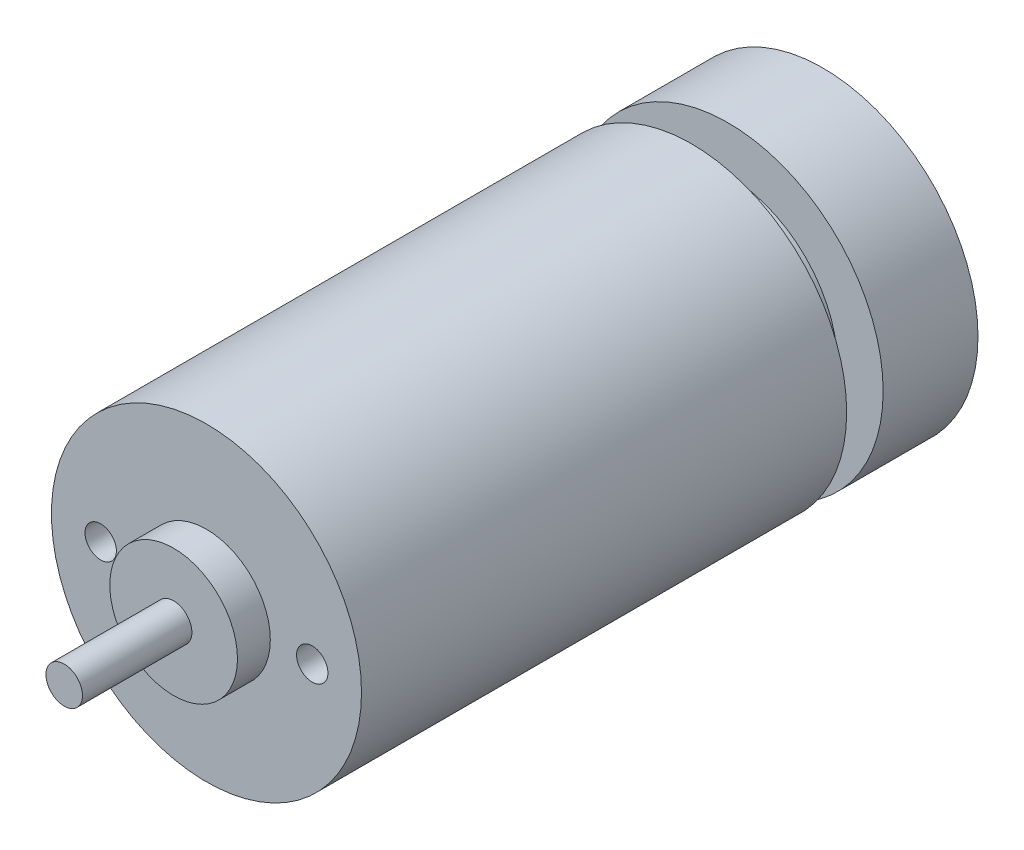
from build123d import *

# Parameters (mm, degrees)
SKIZZE1_R                       = 21.25
AUFSATZ_LINEAR_AUSTRAGEN1_DEPTH = 66.5
SKIZZE2_R                       = 8.75
AUFSATZ_LINEAR_AUSTRAGEN2_DEPTH = 4.5
SKIZZE3_R                       = 2.5
AUFSATZ_LINEAR_AUSTRAGEN3_DEPTH = 15
SKIZZE4_R                       = 2.15
SCHNITT_LINEAR_AUSTRAGEN1_DEPTH = 10
SKIZZE5_R                       = 15
AUFSATZ_LINEAR_AUSTRAGEN4_DEPTH = 5
AUFSATZ_LINEAR_START            = 13
SKIZZE6_R                       = 21.25
AUFSATZ_LINEAR_AUSTRAGEN5_DEPTH = 13


with BuildPart() as part:
    # Skizze1 → Aufsatz-Linear austragen1 (new body)
    with BuildSketch(Plane.XY):
        Circle(SKIZZE1_R)
    extrude(amount=AUFSATZ_LINEAR_AUSTRAGEN1_DEPTH)

    # Skizze2 → Aufsatz-Linear austragen2 (add)
    with BuildSketch(Plane.XY.offset(66.5)):
        Circle(SKIZZE2_R)
    extrude(amount=AUFSATZ_LINEAR_AUSTRAGEN2_DEPTH)

    # Skizze3 → Aufsatz-Linear austragen3 (add)
    with BuildSketch(Plane.XY.offset(71)):
        Circle(SKIZZE3_R)
    extrude(amount=AUFSATZ_LINEAR_AUSTRAGEN3_DEPTH)

    # Skizze4 → Schnitt-Linear austragen1 (cut)
    with BuildSketch(Plane.XY.offset(66.5)):
        with Locations((-14.5, 0)):
            Circle(SKIZZE4_R)
        with Locations((14.5, 0)):
            Circle(SKIZZE4_R)
    extrude(amount=-SCHNITT_LINEAR_AUSTRAGEN1_DEPTH, mode=Mode.SUBTRACT)

    # Skizze5 → Aufsatz-Linear austragen4 (add)
    with BuildSketch(Plane(origin=(0, 0, 0), x_dir=(-1, 0, 0), z_dir=(0, 0, -1))):
        Circle(SKIZZE5_R)
    extrude(amount=AUFSATZ_LINEAR_AUSTRAGEN4_DEPTH)

    # Skizze6 → Aufsatz-Linear austragen5 (add)
    with BuildSketch(Plane(origin=(0, 0, -5), x_dir=(-1, 0, 0), z_dir=(0, 0, -1)).offset(AUFSATZ_LINEAR_START)):
        with Locations(Location((0, 0, 0), (0, 0, 180))):
            Circle(SKIZZE6_R)
    extrude(amount=-AUFSATZ_LINEAR_AUSTRAGEN5_DEPTH)


solid = part.part
